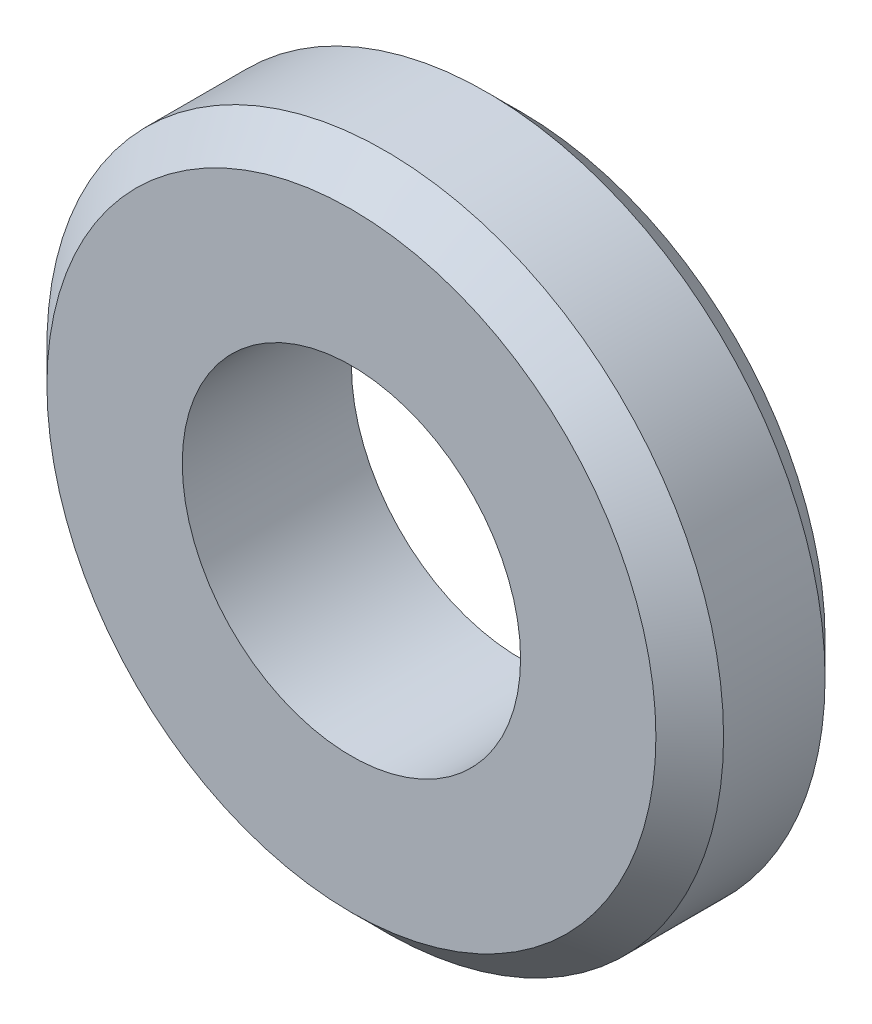
from build123d import *

# Parameters (mm, degrees)
SKETCH1_R           = 1
SKETCH1_R_2         = 0.5
BOSS_EXTRUDE1_DEPTH = 0.5
CHAMFER1_SIZE       = 0.1
SCALE1_SCALE        = 1.9329
SCALE2_SCALE        = 1.5


with BuildPart() as part:
    # Sketch1 → Boss-Extrude1 (new body)
    with BuildSketch(Plane.XY):
        Circle(SKETCH1_R)
        Circle(SKETCH1_R_2, mode=Mode.SUBTRACT)
    extrude(amount=BOSS_EXTRUDE1_DEPTH)

    # Chamfer1
    chamfer1_edges = [part.edges().sort_by_distance(p)[0] for p in [
        (-1, 0, 0),
        (-1, 0, 0.5),
    ]]
    chamfer(chamfer1_edges, length=CHAMFER1_SIZE)


with BuildPart() as part_1:
    # Scale1: scaled about (0, 0, 0.25)
    add(part.part.scale(SCALE1_SCALE).moved(Location((0, 0, -0.233225))))


with BuildPart() as part_2:
    # Scale2: scaled about (0, 0, 0.25)
    add(part_1.part.scale(SCALE2_SCALE).moved(Location((0, 0, -0.125))))


solid = part_2.part
